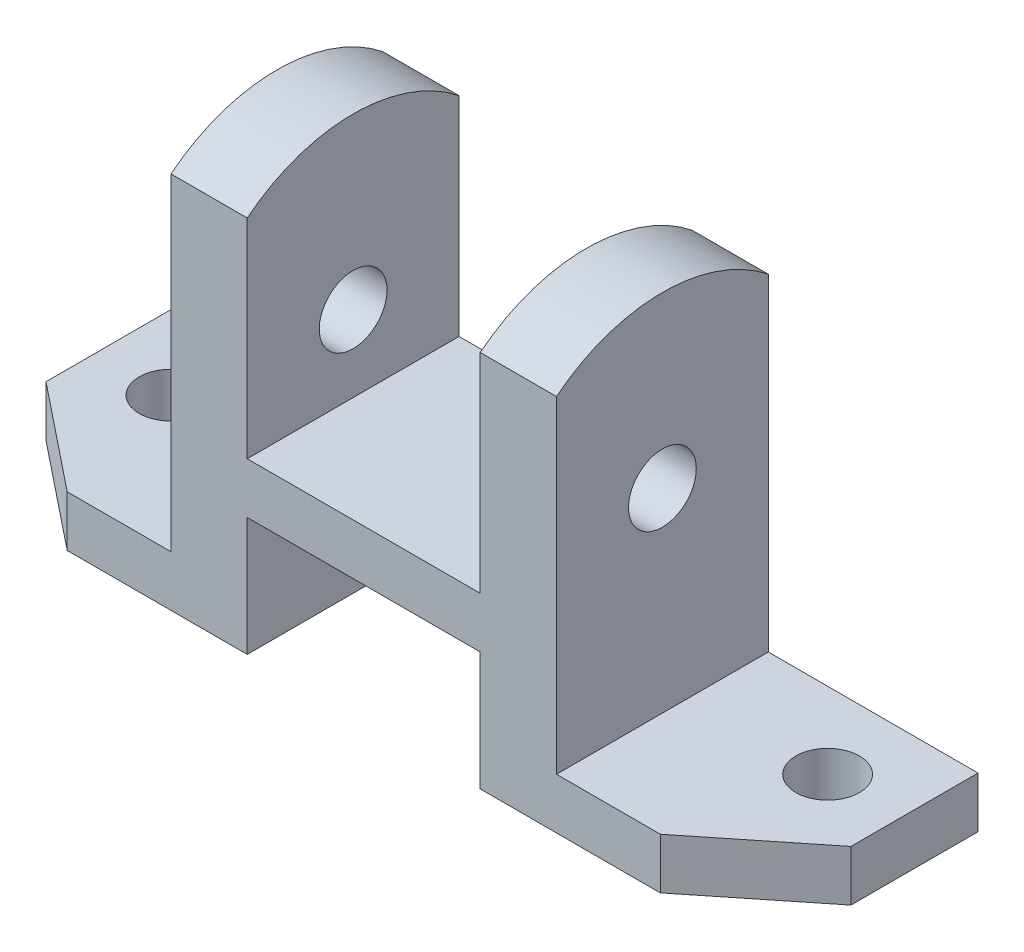
from build123d import *

# Parameters (mm, degrees)
SKETCH1_R           = 7.5
BOSS_EXTRUDE1_DEPTH = 98
SKETCH2_W           = 25
SKETCH2_H           = 86
SKETCH2_W_2         = 24.5
SKETCH2_W_3         = 55
SKETCH2_H_2         = 58
SKETCH2_H_3         = 28
CUT_EXTRUDE1_DEPTH  = 146.358178304
SKETCH3_W           = 55
SKETCH3_H           = 8
BOSS_EXTRUDE2_DEPTH = 28
CUT_EXTRUDE2_REACH  = 175.116
SKETCH4_R           = 8


with BuildPart() as part:
    # Sketch1 → Boss-Extrude1 (new body)
    with BuildSketch(Plane(origin=(0, 0, 0), x_dir=(1, 0, 0), z_dir=(0, 1, 0))):
        Polygon((-95, -5), (-70, -25), (70, -25), (95, -5), (95, 25), (-95, 25), align=None)
        with Locations(Location((-77.5, 7, 0), (0, 0, 270))):
            Circle(SKETCH1_R, mode=Mode.SUBTRACT)
        with Locations(Location((77.5, 7, 0), (0, 0, 270))):
            Circle(SKETCH1_R, mode=Mode.SUBTRACT)
    extrude(amount=BOSS_EXTRUDE1_DEPTH)

    # Sketch2 → Cut-Extrude1 (cut, through all)
    with BuildSketch(Plane.XY.offset(25)):
        with Locations((-82.5, 55)):
            Rectangle(SKETCH2_W, SKETCH2_H)
        with Locations((-57.75, 55)):
            Rectangle(SKETCH2_W_2, SKETCH2_H)
        with Locations((0, 69)):
            Rectangle(SKETCH2_W_3, SKETCH2_H_2)
        with Locations((57.75, 55)):
            Rectangle(SKETCH2_W_2, SKETCH2_H)
        with Locations((82.5, 55)):
            Rectangle(SKETCH2_W, SKETCH2_H)
        with Locations((0, 14)):
            Rectangle(SKETCH2_W_3, SKETCH2_H_3)
    extrude(amount=-CUT_EXTRUDE1_DEPTH, mode=Mode.SUBTRACT)

    # Sketch3 → Boss-Extrude2 (add)
    with BuildSketch(Plane.XZ.offset(-28)):
        with Locations((0, -7)):
            Rectangle(SKETCH3_W, SKETCH3_H)
    extrude(amount=BOSS_EXTRUDE2_DEPTH)

    # Cut-Extrude2: up to this face of the body (flat: up to its plane)
    cut_extrude2_end = Plane(part.part.faces().sort_by_distance((-45.5, 55, 0))[0])
    # Sketch4 → Cut-Extrude2 (cut, up to the picked face)
    with BuildSketch(Plane(origin=(45.5, 0, 0), x_dir=(0, 0, -1), z_dir=(1, 0, 0)), mode=Mode.PRIVATE) as cut_extrude2_sk1:
        with Locations((0, 58)):
            Circle(SKETCH4_R)
    cut_extrude2_tool1 = split(extrude(cut_extrude2_sk1.sketch, amount=-CUT_EXTRUDE2_REACH, mode=Mode.PRIVATE), bisect_by=cut_extrude2_end, keep=Keep.BOTH, mode=Mode.PRIVATE)
    # Sketch4 → Cut-Extrude2 (cut, up to the picked face)
    with BuildSketch(Plane(origin=(45.5, 0, 0), x_dir=(0, 0, -1), z_dir=(1, 0, 0)), mode=Mode.PRIVATE) as cut_extrude2_sk2:
        with BuildLine():
            ThreePointArc((-25, 89.224989992), (-13.247648854, 95.742546282), (0, 98))
            Line((0, 98), (-25, 98))
            Line((-25, 98), (-25, 89.224989992))
        make_face()
    cut_extrude2_tool2 = split(extrude(cut_extrude2_sk2.sketch, amount=-CUT_EXTRUDE2_REACH, mode=Mode.PRIVATE), bisect_by=cut_extrude2_end, keep=Keep.BOTH, mode=Mode.PRIVATE)
    # Sketch4 → Cut-Extrude2 (cut, up to the picked face)
    with BuildSketch(Plane(origin=(45.5, 0, 0), x_dir=(0, 0, -1), z_dir=(1, 0, 0)), mode=Mode.PRIVATE) as cut_extrude2_sk3:
        with BuildLine():
            ThreePointArc((0, 98), (13.247648854, 95.742546282), (25, 89.224989992))
            Line((25, 89.224989992), (25, 98))
            Line((25, 98), (0, 98))
        make_face()
    cut_extrude2_tool3 = split(extrude(cut_extrude2_sk3.sketch, amount=-CUT_EXTRUDE2_REACH, mode=Mode.PRIVATE), bisect_by=cut_extrude2_end, keep=Keep.BOTH, mode=Mode.PRIVATE)
    add(cut_extrude2_tool1.solids().sort_by(Axis((45.5, 58, 0), (-1, 0, 0)))[0], mode=Mode.SUBTRACT)
    add(cut_extrude2_tool2.solids().sort_by(Axis((45.5, 95.425652, 18.895417), (-1, 0, 0)))[0], mode=Mode.SUBTRACT)
    add(cut_extrude2_tool3.solids().sort_by(Axis((45.5, 95.425652, -18.895417), (-1, 0, 0)))[0], mode=Mode.SUBTRACT)


solid = part.part
